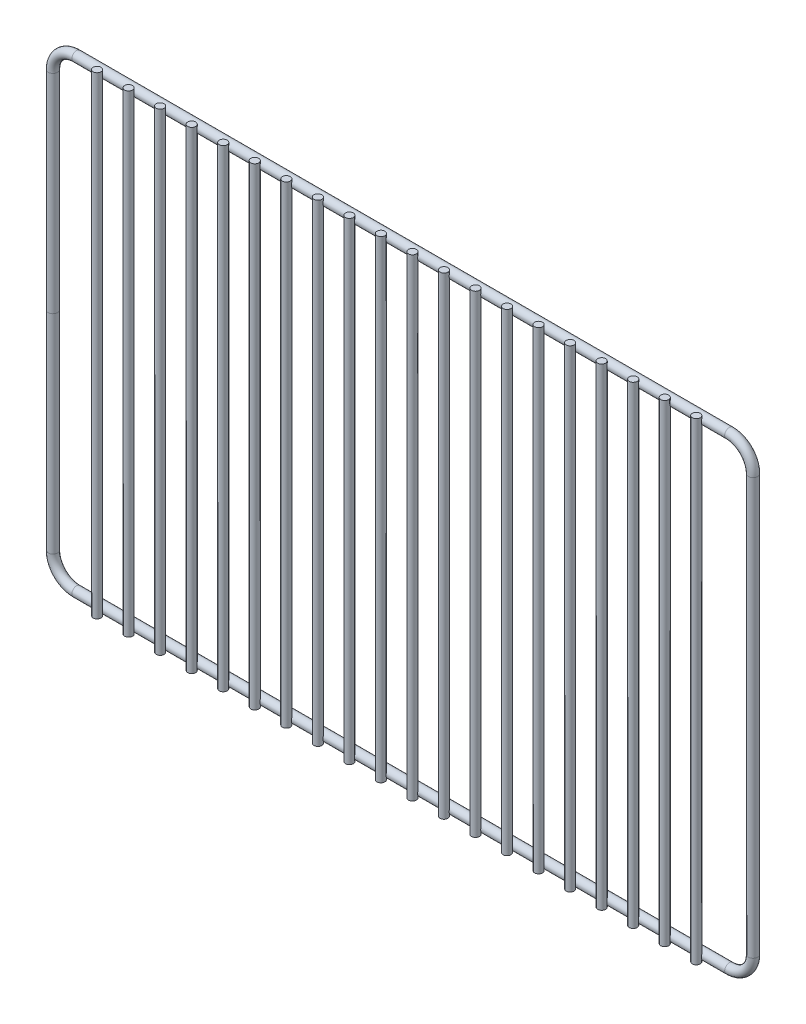
from build123d import *

# Parameters (mm, degrees)
SKETCH3_R       = 3
SKETCH5_R       = 2.5
LPATTERN1_COUNT = 20
LPATTERN1_PITCH = 20


with BuildPart() as part:
    # Sweep1: sweep along a path in Sketch2
    with BuildLine(Plane.XY) as sweep1_path:
        Line((207, 147), (-207, 147))
        ThreePointArc((-207, 147), (-217.606601718, 142.606601718), (-222, 132))
        Line((-222, 132), (-222, -132))
        ThreePointArc((-222, -132), (-217.606601718, -142.606601718), (-207, -147))
        Line((-207, -147), (207, -147))
        ThreePointArc((207, -147), (217.606601718, -142.606601718), (222, -132))
        Line((222, -132), (222, 132))
        ThreePointArc((222, 132), (217.606601718, 142.606601718), (207, 147))
    # Sketch3 → Sweep1 (sweep)
    with BuildSketch(Plane(origin=(0, 0, 0), x_dir=(1, 0, 0), z_dir=(0, 1, 0))):
        with Locations((-222, 0)):
            Circle(SKETCH3_R)
    sweep(path=sweep1_path.line)

    # Sweep2: sweep along a path in Sketch4
    with BuildLine(Plane.XY.offset(4)) as sweep2_path:
        Line((-190, 150), (-190, -150))
    # Sketch5 → Sweep2 (sweep)
    with BuildSketch(Plane(origin=(0, 0, 0), x_dir=(1, 0, 0), z_dir=(0, 1, 0))):
        with Locations((-190, -4)):
            Circle(SKETCH5_R)
    sweep2 = sweep(path=sweep2_path.line)

    # LPattern1: Sweep2 ×20
    with Locations(*[(i * LPATTERN1_PITCH, 0, 0) for i in range(1, LPATTERN1_COUNT)]):
        add(sweep2)


solid = part.part
